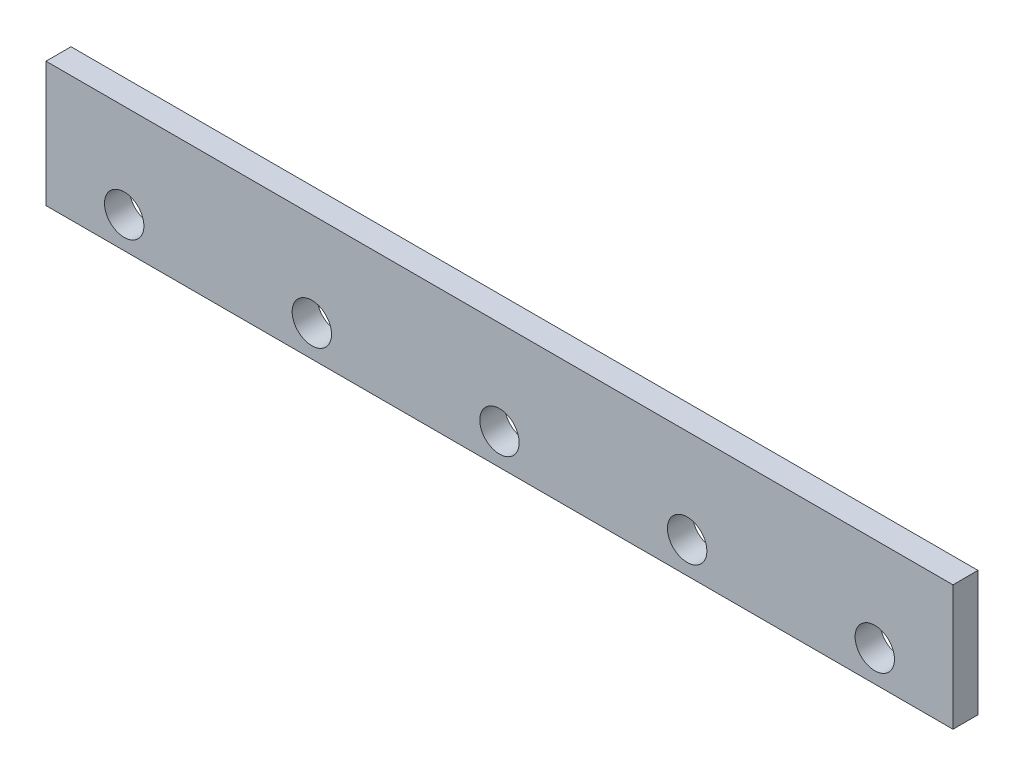
from build123d import *

# Parameters (mm, degrees)
EXTRUDE_1_DEPTH        = 8
EXTRUDE_1_DEPTH_BACK   = 8
SKETCH_1_W             = 580
SKETCH_1_H             = 80
SKETCH_2_R             = 12.6
EXTRUDE_2_DEPTH        = 16
PATTERN_LINEAR_1_COUNT = 5
PATTERN_LINEAR_1_PITCH = 120


with BuildPart() as part:
    # 草圖1 → 擠出1 (new, two sides: drawn at the far end of the back side and taken through both)
    with BuildSketch(Plane.XY.offset(-EXTRUDE_1_DEPTH_BACK)):
        with Locations((290, 40)):
            Rectangle(SKETCH_1_W, SKETCH_1_H)
    extrude(amount=EXTRUDE_1_DEPTH + EXTRUDE_1_DEPTH_BACK)

    # 草圖2 → 擠出2 (cut)
    with BuildSketch(Plane.XY.offset(8)):
        with Locations((50, 20)):
            Circle(SKETCH_2_R)
    extrude_2 = extrude(amount=-EXTRUDE_2_DEPTH, mode=Mode.SUBTRACT)

    # 矩形陣列1: 擠出2 ×5
    with Locations(*[(i * PATTERN_LINEAR_1_PITCH, 0, 0) for i in range(1, PATTERN_LINEAR_1_COUNT)]):
        add(extrude_2, mode=Mode.SUBTRACT)


solid = part.part
